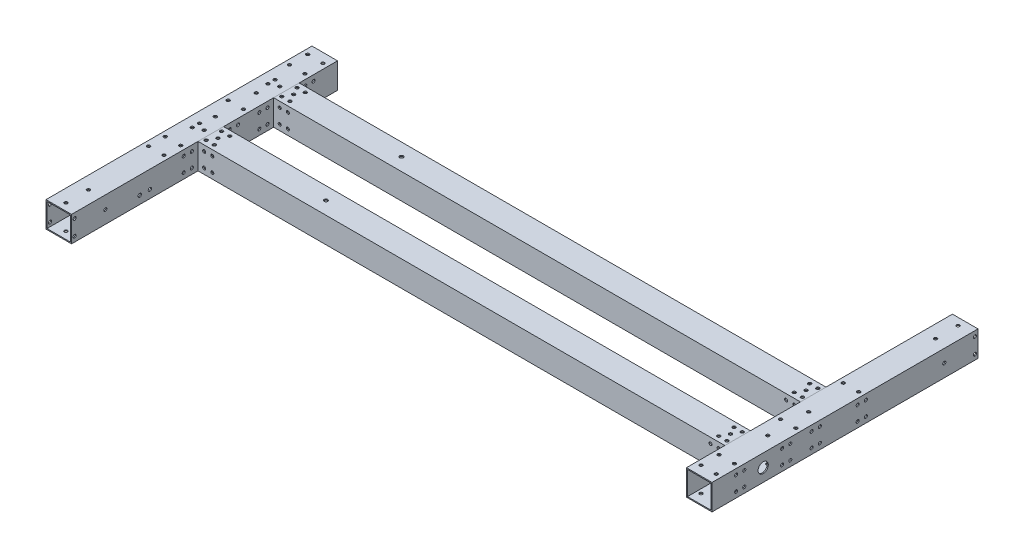
from build123d import *

# Parameters (mm, degrees)
F_20X20X1_1_DEPTH         = 541
F_20X20X1_1_DEPTH_BACK    = 1
SKETCH_1_W                = 25
SKETCH_1_H                = 25
SKETCH_1_W_2              = 23
SKETCH_1_H_2              = 23
SKETCH_1_ON_SEGMENT_2_W   = 25
SKETCH_1_ON_SEGMENT_2_H   = 25
SKETCH_1_ON_SEGMENT_2_W_2 = 23
SKETCH_1_ON_SEGMENT_2_H_2 = 23
F_20X20X1_1_2_DEPTH       = 542
SKETCH_1_ON_SEGMENT_3_W   = 25
SKETCH_1_ON_SEGMENT_3_H   = 25
SKETCH_1_ON_SEGMENT_3_W_2 = 23
SKETCH_1_ON_SEGMENT_3_H_2 = 23
F_20X20X1_1_3_DEPTH       = 260
SKETCH_1_ON_SEGMENT_4_W   = 25
SKETCH_1_ON_SEGMENT_4_H   = 25
SKETCH_1_ON_SEGMENT_4_W_2 = 23
SKETCH_1_ON_SEGMENT_4_H_2 = 23
F_20X20X1_1_4_DEPTH       = 260
SKETCH_2_R                = 5
CUT_EXTRUDE_1_DEPTH       = 603.894062004
SKETCH_3_R                = 1.75
CUT_EXTRUDE_2_DEPTH       = 592.592131455
SKETCH_4_R                = 1.55
CUT_EXTRUDE_3_DEPTH       = 592.592131455
SKETCH_5_R                = 1.55
CUT_EXTRUDE_4_DEPTH       = 592.592131455
SKETCH_6_R                = 1.55
CUT_EXTRUDE_5_DEPTH       = 603.894062004
SKETCH_7_R                = 1.5
CUT_EXTRUDE_6_DEPTH       = 596.750577003
CUT_EXTRUDE_11_DEPTH      = 580.531060427
CUT_EXTRUDE_11_DEPTH_BACK = 580.531060427
SKETCH_10_R               = 1.5
SKETCH_11_R               = 1.65
CUT_EXTRUDE_12_DEPTH      = 580.531060427
SKETCH_12_R               = 1.55
CUT_EXTRUDE_13_DEPTH      = 592.592131455
SKETCH_13_R               = 1.55
CUT_EXTRUDE_14_DEPTH      = 592.592131455


with BuildPart() as part:
    # 草图1 → 方形管 20X20X1(1) (new, two sides: drawn at the far end of the back side and taken through both)
    with BuildSketch(Plane(origin=(0, 0, 0), x_dir=(0, 0, -1), z_dir=(1, 0, 0)).offset(-F_20X20X1_1_DEPTH_BACK)):
        Rectangle(SKETCH_1_W, SKETCH_1_H)
        Rectangle(SKETCH_1_W_2, SKETCH_1_H_2, mode=Mode.SUBTRACT)
    extrude(amount=F_20X20X1_1_DEPTH + F_20X20X1_1_DEPTH_BACK)

    # 方形管 20X20X1(1) end butt 1
    split(bisect_by=Plane.YZ.offset(12.5), keep=Keep.TOP)

    # 方形管 20X20X1(1) end butt 2
    split(bisect_by=Plane(origin=(527.5, 0, 0), x_dir=(0, -1, 0), z_dir=(-1, 0, 0)), keep=Keep.TOP)


with BuildPart() as body_2:
    # 草图1 on segment 2 (carried to segment 2) → 20X20X1_1 2 (new body)
    with BuildSketch(Plane(origin=(-1, 0, -73.9), x_dir=(0, 0, -1), z_dir=(1, 0, 0))):
        Rectangle(SKETCH_1_ON_SEGMENT_2_W, SKETCH_1_ON_SEGMENT_2_H)
        Rectangle(SKETCH_1_ON_SEGMENT_2_W_2, SKETCH_1_ON_SEGMENT_2_H_2, mode=Mode.SUBTRACT)
    extrude(amount=F_20X20X1_1_2_DEPTH)

    # 20X20X1_1 2 end butt 1
    split(bisect_by=Plane(origin=(12.5, 0, -73.9), x_dir=(0, 1, 0), z_dir=(1, 0, 0)), keep=Keep.TOP)

    # 20X20X1_1 2 end butt 2
    split(bisect_by=Plane(origin=(527.5, 0, -73.9), x_dir=(0, -1, 0), z_dir=(-1, 0, 0)), keep=Keep.TOP)


with BuildPart() as body_3:
    # 草图1 on segment 3 (carried to segment 3) → 20X20X1_1 3 (new body)
    with BuildSketch(Plane(origin=(0, 0, 136.1), x_dir=(-1, 0, 0), z_dir=(0, 0, -1))):
        Rectangle(SKETCH_1_ON_SEGMENT_3_W, SKETCH_1_ON_SEGMENT_3_H)
        Rectangle(SKETCH_1_ON_SEGMENT_3_W_2, SKETCH_1_ON_SEGMENT_3_H_2, mode=Mode.SUBTRACT)
    extrude(amount=F_20X20X1_1_3_DEPTH)


with BuildPart() as body_4:
    # 草图1 on segment 4 (carried to segment 4) → 20X20X1_1 4 (new body)
    with BuildSketch(Plane(origin=(540, 0, -210), x_dir=(1, 0, 0), z_dir=(0, 0, 1))):
        Rectangle(SKETCH_1_ON_SEGMENT_4_W, SKETCH_1_ON_SEGMENT_4_H)
        Rectangle(SKETCH_1_ON_SEGMENT_4_W_2, SKETCH_1_ON_SEGMENT_4_H_2, mode=Mode.SUBTRACT)
    extrude(amount=F_20X20X1_1_4_DEPTH)


with BuildPart() as cut_extrude_1_tool:
    # 草图2 → 切除-拉伸1 (new, through all)
    with BuildSketch(Plane(origin=(552.5, 0, 0), x_dir=(0, 0, -1), z_dir=(1, 0, 0))):
        with Locations(Location((0, 0, 0), (0, 0, 90))):
            Circle(SKETCH_2_R)
    extrude(amount=-CUT_EXTRUDE_1_DEPTH)


with BuildPart() as body_3_1:
    add(body_3.part)

    # 切除-拉伸1: cut by cut_extrude_1_tool
    add(cut_extrude_1_tool.part, mode=Mode.SUBTRACT)


with BuildPart() as body_4_1:
    add(body_4.part)

    # 切除-拉伸1: cut by cut_extrude_1_tool
    add(cut_extrude_1_tool.part, mode=Mode.SUBTRACT)


with BuildPart() as cut_extrude_2_tool:
    # 草图3 → 切除-拉伸2 (new, through all)
    with BuildSketch(Plane(origin=(0, 12.5, 0), x_dir=(1, 0, 0), z_dir=(0, 1, 0))):
        with Locations(Location((125, 0, 0), (0, 0, 270))):
            Circle(SKETCH_3_R)
        with Locations(Location((125, 73.9, 0), (0, 0, 270))):
            Circle(SKETCH_3_R)
    extrude(amount=-CUT_EXTRUDE_2_DEPTH)


with BuildPart() as part_1:
    add(part.part)

    # 切除-拉伸2: cut by cut_extrude_2_tool
    add(cut_extrude_2_tool.part, mode=Mode.SUBTRACT)


with BuildPart() as body_2_1:
    add(body_2.part)

    # 切除-拉伸2: cut by cut_extrude_2_tool
    add(cut_extrude_2_tool.part, mode=Mode.SUBTRACT)


with BuildPart() as cut_extrude_3_tool:
    # 草图4 → 切除-拉伸3 (new, through all)
    with BuildSketch(Plane.XZ.offset(12.5)):
        with Locations((532.5, -98.4)):
            Circle(SKETCH_4_R)
        with Locations((520.5, -73.9)):
            Circle(SKETCH_4_R)
        with Locations((516.5, -66.4)):
            Circle(SKETCH_4_R)
        with Locations((524.5, -81.4)):
            Circle(SKETCH_4_R)
        with Locations((516.5, -81.4)):
            Circle(SKETCH_4_R)
        with Locations((524.5, -66.4)):
            Circle(SKETCH_4_R)
        with Locations((547.5, -98.4)):
            Circle(SKETCH_4_R)
        with Locations((540, -16.95)):
            Circle(SKETCH_4_R)
        with Locations((547.5, -36.95)):
            Circle(SKETCH_4_R)
        with Locations((532.5, -36.95)):
            Circle(SKETCH_4_R)
        with Locations((540, -56.95)):
            Circle(SKETCH_4_R)
        with Locations((516.5, 7.5)):
            Circle(SKETCH_4_R)
        with Locations((524.5, 7.5)):
            Circle(SKETCH_4_R)
        with Locations((547.5, 23.05)):
            Circle(SKETCH_4_R)
        with Locations((532.5, 23.05)):
            Circle(SKETCH_4_R)
        with Locations((520.5, 0)):
            Circle(SKETCH_4_R)
        with Locations((524.5, -7.5)):
            Circle(SKETCH_4_R)
        with Locations((516.5, -7.5)):
            Circle(SKETCH_4_R)
        with Locations((540, -203)):
            Circle(SKETCH_4_R)
        with Locations((540, -181)):
            Circle(SKETCH_4_R)
    extrude(amount=-CUT_EXTRUDE_3_DEPTH)


with BuildPart() as part_2:
    add(part_1.part)

    # 切除-拉伸3: cut by cut_extrude_3_tool
    add(cut_extrude_3_tool.part, mode=Mode.SUBTRACT)


with BuildPart() as body_2_2:
    add(body_2_1.part)

    # 切除-拉伸3: cut by cut_extrude_3_tool
    add(cut_extrude_3_tool.part, mode=Mode.SUBTRACT)


with BuildPart() as body_4_2:
    add(body_4_1.part)

    # 切除-拉伸3: cut by cut_extrude_3_tool
    add(cut_extrude_3_tool.part, mode=Mode.SUBTRACT)


with BuildPart() as cut_extrude_4_tool:
    # 草图5 → 切除-拉伸4 (new, through all)
    with BuildSketch(Plane.XZ.offset(12.5)):
        with Locations((15.5, 7.5)):
            Circle(SKETCH_5_R)
        with Locations((23.5, 7.5)):
            Circle(SKETCH_5_R)
        with Locations((15.5, -7.5)):
            Circle(SKETCH_5_R)
        with Locations((23.5, -7.5)):
            Circle(SKETCH_5_R)
        with Locations((19.5, 0)):
            Circle(SKETCH_5_R)
        with Locations((-7.5, 24.5)):
            Circle(SKETCH_5_R)
        with Locations((7.5, 24.5)):
            Circle(SKETCH_5_R)
        with Locations((-2, 3.5)):
            Circle(SKETCH_5_R)
        with Locations((6, 0)):
            Circle(SKETCH_5_R)
        with Locations((-2, -3.5)):
            Circle(SKETCH_5_R)
        with Locations((7.5, -36.95)):
            Circle(SKETCH_5_R)
        with Locations((-7.5, -36.95)):
            Circle(SKETCH_5_R)
        with Locations((0, -16.95)):
            Circle(SKETCH_5_R)
        with Locations((-7.5, -96.95)):
            Circle(SKETCH_5_R)
        with Locations((7.5, -96.95)):
            Circle(SKETCH_5_R)
        with Locations((-2, -77.4)):
            Circle(SKETCH_5_R)
        with Locations((-2, -70.4)):
            Circle(SKETCH_5_R)
        with Locations((0, -56.95)):
            Circle(SKETCH_5_R)
        with Locations((6, -73.9)):
            Circle(SKETCH_5_R)
        with Locations((15.5, -81.4)):
            Circle(SKETCH_5_R)
        with Locations((23.5, -81.4)):
            Circle(SKETCH_5_R)
        with Locations((19.5, -73.9)):
            Circle(SKETCH_5_R)
        with Locations((15.5, -66.4)):
            Circle(SKETCH_5_R)
        with Locations((23.5, -66.4)):
            Circle(SKETCH_5_R)
        with Locations((0, 107.1)):
            Circle(SKETCH_5_R)
        with Locations((0, 129.1)):
            Circle(SKETCH_5_R)
    extrude(amount=-CUT_EXTRUDE_4_DEPTH)


with BuildPart() as part_3:
    add(part_2.part)

    # 切除-拉伸4: cut by cut_extrude_4_tool
    add(cut_extrude_4_tool.part, mode=Mode.SUBTRACT)


with BuildPart() as body_2_3:
    add(body_2_2.part)

    # 切除-拉伸4: cut by cut_extrude_4_tool
    add(cut_extrude_4_tool.part, mode=Mode.SUBTRACT)


with BuildPart() as body_3_2:
    add(body_3_1.part)

    # 切除-拉伸4: cut by cut_extrude_4_tool
    add(cut_extrude_4_tool.part, mode=Mode.SUBTRACT)


with BuildPart() as cut_extrude_5_tool:
    # 草图6 → 切除-拉伸5 (new, through all)
    with BuildSketch(Plane.ZY.offset(12.5)):
        with Locations(Location((133.1, -7.5, 0), (0, 0, 270))):
            Circle(SKETCH_6_R)
        with Locations(Location((103.1, 0, 0), (0, 0, 270))):
            Circle(SKETCH_6_R)
        with Locations(Location((-207, -7.5, 0), (0, 0, 270))):
            Circle(SKETCH_6_R)
        with Locations(Location((-177, 0, 0), (0, 0, 270))):
            Circle(SKETCH_6_R)
        with Locations(Location((133.1, 7.5, 0), (0, 0, 270))):
            Circle(SKETCH_6_R)
        with Locations(Location((-207, 7.5, 0), (0, 0, 270))):
            Circle(SKETCH_6_R)
    extrude(amount=-CUT_EXTRUDE_5_DEPTH)


with BuildPart() as body_3_3:
    add(body_3_2.part)

    # 切除-拉伸5: cut by cut_extrude_5_tool
    add(cut_extrude_5_tool.part, mode=Mode.SUBTRACT)


with BuildPart() as body_4_3:
    add(body_4_2.part)

    # 切除-拉伸5: cut by cut_extrude_5_tool
    add(cut_extrude_5_tool.part, mode=Mode.SUBTRACT)


with BuildPart() as cut_extrude_6_tool:
    # 草图7 → 切除-拉伸6 (new, through all)
    with BuildSketch(Plane(origin=(0, 0, -86.4), x_dir=(-1, 0, 0), z_dir=(0, 0, -1))):
        with Locations(Location((-513.5, 7, 0), (0, 0, 270))):
            Circle(SKETCH_7_R)
        with Locations(Location((-513.5, -7, 0), (0, 0, 270))):
            Circle(SKETCH_7_R)
        with Locations(Location((-521.5, 7, 0), (0, 0, 270))):
            Circle(SKETCH_7_R)
        with Locations(Location((-521.5, -7, 0), (0, 0, 270))):
            Circle(SKETCH_7_R)
        with Locations(Location((-18.5, -7, 0), (0, 0, 270))):
            Circle(SKETCH_7_R)
        with Locations(Location((-18.5, 7, 0), (0, 0, 270))):
            Circle(SKETCH_7_R)
        with Locations(Location((-26.5, -7, 0), (0, 0, 270))):
            Circle(SKETCH_7_R)
        with Locations(Location((-26.5, 7, 0), (0, 0, 270))):
            Circle(SKETCH_7_R)
    extrude(amount=-CUT_EXTRUDE_6_DEPTH)


with BuildPart() as part_4:
    add(part_3.part)

    # 切除-拉伸6: cut by cut_extrude_6_tool
    add(cut_extrude_6_tool.part, mode=Mode.SUBTRACT)


with BuildPart() as body_2_4:
    add(body_2_3.part)

    # 切除-拉伸6: cut by cut_extrude_6_tool
    add(cut_extrude_6_tool.part, mode=Mode.SUBTRACT)


with BuildPart() as cut_extrude_11_tool:
    # 草图10 → 切除-拉伸11 (new, two sides: drawn at the far end of the back side and taken through both)
    with BuildSketch(Plane.ZY.offset(-527.5).offset(-CUT_EXTRUDE_11_DEPTH_BACK)):
        with Locations(Location((-92.4, -7, 0), (0, 0, 270))):
            Circle(SKETCH_10_R)
        with Locations(Location((-100.4, -7, 0), (0, 0, 270))):
            Circle(SKETCH_10_R)
        with Locations(Location((-100.4, 7, 0), (0, 0, 270))):
            Circle(SKETCH_10_R)
        with Locations(Location((-92.4, 7, 0), (0, 0, 270))):
            Circle(SKETCH_10_R)
        with Locations(Location((-55.4, 7, 0), (0, 0, 270))):
            Circle(SKETCH_10_R)
        with Locations(Location((-47.4, 7, 0), (0, 0, 270))):
            Circle(SKETCH_10_R)
        with Locations(Location((-47.4, -7, 0), (0, 0, 270))):
            Circle(SKETCH_10_R)
        with Locations(Location((-55.4, -7, 0), (0, 0, 270))):
            Circle(SKETCH_10_R)
        with Locations(Location((18.5, 7, 0), (0, 0, 270))):
            Circle(SKETCH_10_R)
        with Locations(Location((26.5, 7, 0), (0, 0, 270))):
            Circle(SKETCH_10_R)
        with Locations(Location((26.5, -7, 0), (0, 0, 270))):
            Circle(SKETCH_10_R)
        with Locations(Location((18.5, -7, 0), (0, 0, 270))):
            Circle(SKETCH_10_R)
        with Locations(Location((-18.5, -7, 0), (0, 0, 270))):
            Circle(SKETCH_10_R)
        with Locations(Location((-26.5, -7, 0), (0, 0, 270))):
            Circle(SKETCH_10_R)
        with Locations(Location((-26.5, 7, 0), (0, 0, 270))):
            Circle(SKETCH_10_R)
        with Locations(Location((-18.5, 7, 0), (0, 0, 270))):
            Circle(SKETCH_10_R)
    extrude(amount=CUT_EXTRUDE_11_DEPTH + CUT_EXTRUDE_11_DEPTH_BACK)


with BuildPart() as body_3_4:
    add(body_3_3.part)

    # 切除-拉伸11: cut by cut_extrude_11_tool
    add(cut_extrude_11_tool.part, mode=Mode.SUBTRACT)

    # 草图11 → 切除-拉伸12 (cut, through all)
    with BuildSketch(Plane(origin=(12.5, 0, 0), x_dir=(0, 0, -1), z_dir=(1, 0, 0))):
        with Locations(Location((-69.5, -4.7, 0), (0, 0, 90))):
            Circle(SKETCH_11_R)
        with Locations(Location((-59.5, -4.7, 0), (0, 0, 90))):
            Circle(SKETCH_11_R)
    extrude(amount=-CUT_EXTRUDE_12_DEPTH, mode=Mode.SUBTRACT)


with BuildPart() as body_4_4:
    add(body_4_3.part)

    # 切除-拉伸11: cut by cut_extrude_11_tool
    add(cut_extrude_11_tool.part, mode=Mode.SUBTRACT)


with BuildPart() as cut_extrude_13_tool:
    # 草图12 → 切除-拉伸13 (new, through all)
    with BuildSketch(Plane.XZ.offset(12.5)):
        with Locations(Location((547.5, 40.75, 0), (0, 0, 270))):
            Circle(SKETCH_12_R)
        with Locations(Location((532.5, 40.75, 0), (0, 0, 270))):
            Circle(SKETCH_12_R)
        with Locations(Location((-7.5, 40.75, 0), (0, 0, 270))):
            Circle(SKETCH_12_R)
        with Locations(Location((7.5, 40.75, 0), (0, 0, 270))):
            Circle(SKETCH_12_R)
    extrude(amount=-CUT_EXTRUDE_13_DEPTH)


with BuildPart() as body_3_5:
    add(body_3_4.part)

    # 切除-拉伸13: cut by cut_extrude_13_tool
    add(cut_extrude_13_tool.part, mode=Mode.SUBTRACT)

    # 草图13 → 切除-拉伸14 (cut, through all)
    with BuildSketch(Plane.XZ.offset(12.5)):
        with Locations((7.5, -114.65)):
            Circle(SKETCH_13_R)
        with Locations((-7.5, -114.65)):
            Circle(SKETCH_13_R)
    extrude(amount=-CUT_EXTRUDE_14_DEPTH, mode=Mode.SUBTRACT)


with BuildPart() as body_4_5:
    add(body_4_4.part)

    # 切除-拉伸13: cut by cut_extrude_13_tool
    add(cut_extrude_13_tool.part, mode=Mode.SUBTRACT)


solid = Compound([part_4.part, body_2_4.part, body_3_5.part, body_4_5.part])
